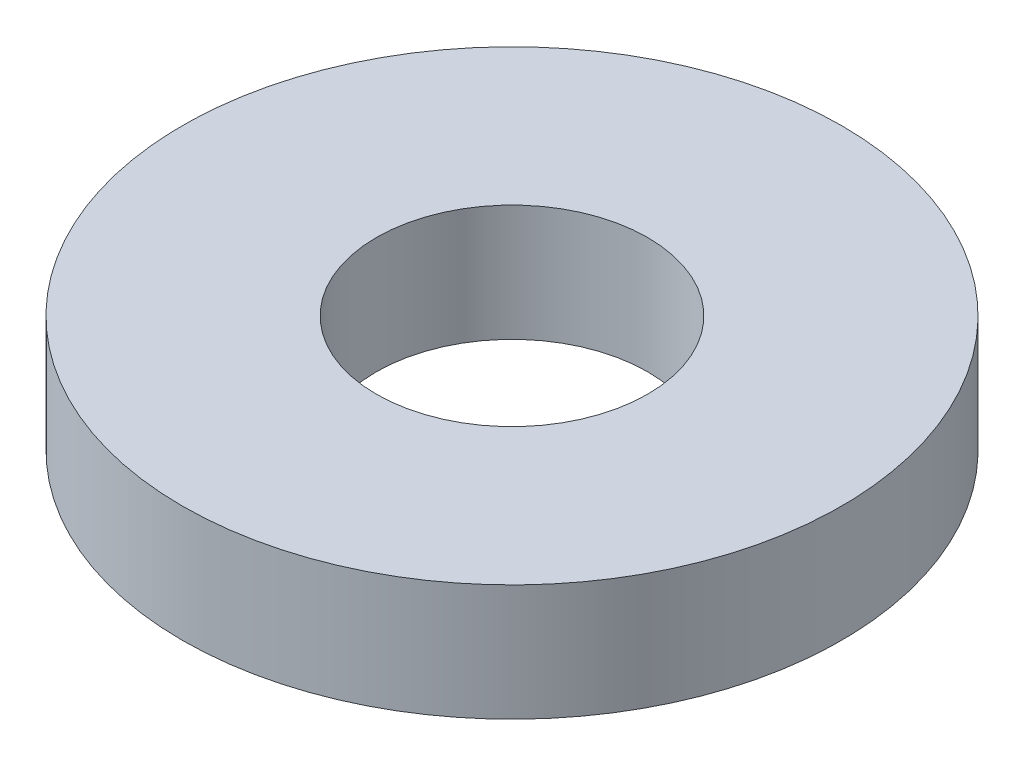
from build123d import *

# Parameters (mm, degrees)
SKETCH2_R           = 17
SKETCH2_R_2         = 7
BOSS_EXTRUDE1_DEPTH = 6


with BuildPart() as part:
    # Sketch2 → Boss-Extrude1 (new body)
    with BuildSketch(Plane(origin=(0, 0, 0), x_dir=(1, 0, 0), z_dir=(0, 1, 0))):
        with Locations(Location((0, 0, 0), (0, 0, 270))):
            Circle(SKETCH2_R)
        with Locations(Location((0, 0, 0), (0, 0, 270))):
            Circle(SKETCH2_R_2, mode=Mode.SUBTRACT)
    extrude(amount=BOSS_EXTRUDE1_DEPTH)


solid = part.part
